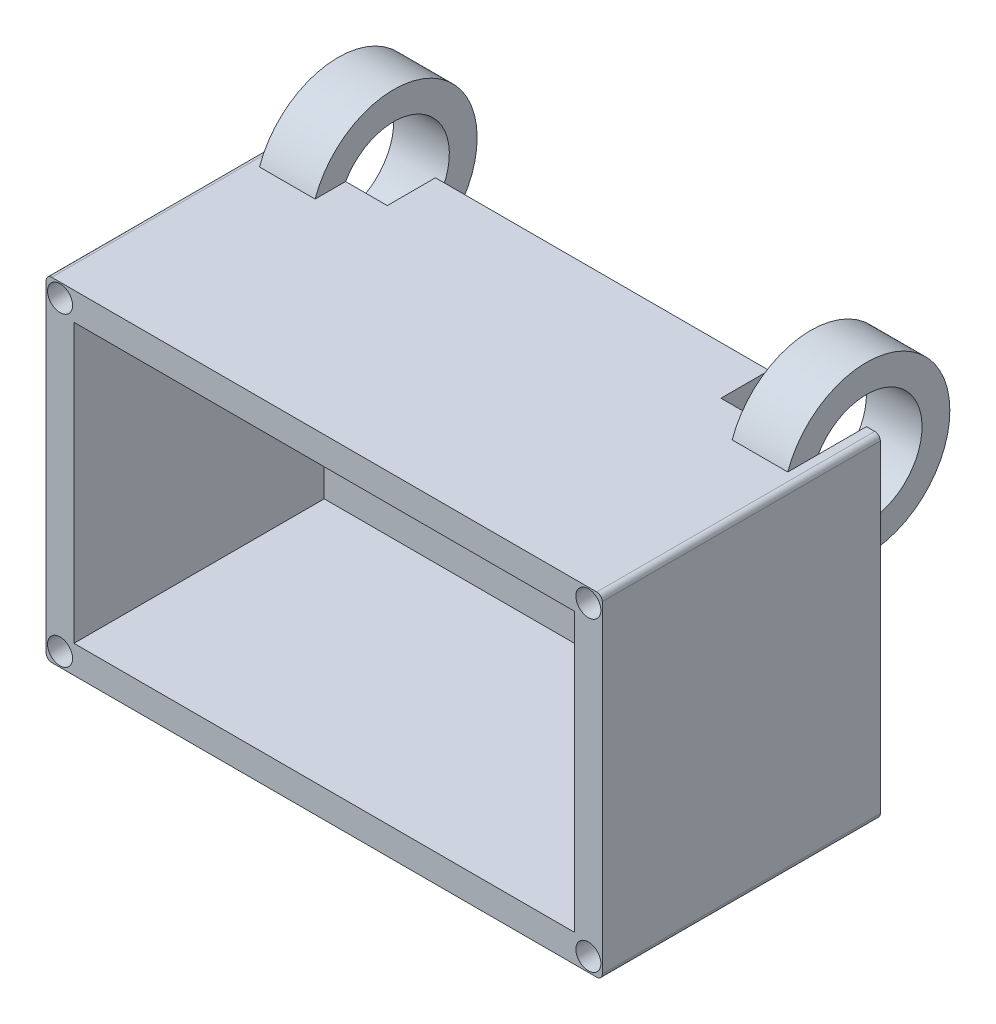
from build123d import *

# Parameters (mm, degrees)
SKETCH1_W           = 200
SKETCH1_H           = 120
BOSS_EXTRUDE1_DEPTH = 100
SHELL1_T            = -10
SKETCH2_R           = 30
BOSS_EXTRUDE2_DEPTH = 20
BOSS_EXTRUDE3_START = 20
SKETCH3_R           = 30
BOSS_EXTRUDE3_DEPTH = 20
SKETCH4_R           = 20
CUT_EXTRUDE1_DEPTH  = 35
CUT_EXTRUDE2_START  = -35
SKETCH5_R           = 20
CUT_EXTRUDE2_DEPTH  = 35
SKETCH7_R           = 4.5
CUT_EXTRUDE3_DEPTH  = 10
CUT_EXTRUDE4_START  = 10
SKETCH8_R           = 4.5
CUT_EXTRUDE4_DEPTH  = 10
FILLET1_R           = 2


with BuildPart() as part:
    # Sketch1 → Boss-Extrude1 (new body)
    with BuildSketch(Plane.XY):
        Rectangle(SKETCH1_W, SKETCH1_H)
    extrude(amount=BOSS_EXTRUDE1_DEPTH)

    # Shell1
    shell1_openings = [part.faces().sort_by_distance(p)[0] for p in [
        (0, 0, 100),
    ]]
    offset(amount=SHELL1_T, openings=shell1_openings, kind=Kind.INTERSECTION)

    # Sketch2 → Boss-Extrude2 (add)
    with BuildSketch(Plane(origin=(-75, 0, 0), x_dir=(0, 0, -1), z_dir=(1, 0, 0))):
        with Locations((0, 50)):
            Circle(SKETCH2_R)
    extrude(amount=-BOSS_EXTRUDE2_DEPTH)

    # Sketch3 → Boss-Extrude3 (add)
    with BuildSketch(Plane(origin=(75, 0, 0), x_dir=(0, 0, -1), z_dir=(1, 0, 0)).offset(BOSS_EXTRUDE3_START)):
        with Locations((0, 50)):
            Circle(SKETCH3_R)
    extrude(amount=-BOSS_EXTRUDE3_DEPTH)

    # Sketch4 → Cut-Extrude1 (cut)
    with BuildSketch(Plane(origin=(-95, 0, 0), x_dir=(0, 0, -1), z_dir=(1, 0, 0))):
        with Locations((0, 50)):
            Circle(SKETCH4_R)
    extrude(amount=CUT_EXTRUDE1_DEPTH, mode=Mode.SUBTRACT)

    # Sketch5 → Cut-Extrude2 (cut)
    with BuildSketch(Plane(origin=(95, 0, 0), x_dir=(0, 0, -1), z_dir=(1, 0, 0)).offset(CUT_EXTRUDE2_START)):
        with Locations((0, 50)):
            Circle(SKETCH5_R)
    extrude(amount=CUT_EXTRUDE2_DEPTH, mode=Mode.SUBTRACT)

    # Sketch7 → Cut-Extrude3 (cut)
    with BuildSketch(Plane.XY.offset(100)):
        with Locations((95, 55)):
            Circle(SKETCH7_R)
        with Locations((95, -55)):
            Circle(SKETCH7_R)
        with Locations((-95, 55)):
            Circle(SKETCH7_R)
        with Locations((-95, -55)):
            Circle(SKETCH7_R)
    extrude(amount=-CUT_EXTRUDE3_DEPTH, mode=Mode.SUBTRACT)

    # Sketch8 → Cut-Extrude4 (cut)
    with BuildSketch(Plane.XY.offset(CUT_EXTRUDE4_START)):
        with Locations((95, 55)):
            Circle(SKETCH8_R)
        with Locations((95, -55)):
            Circle(SKETCH8_R)
        with Locations((-95, 55)):
            Circle(SKETCH8_R)
        with Locations((-95, -55)):
            Circle(SKETCH8_R)
    extrude(amount=-CUT_EXTRUDE4_DEPTH, mode=Mode.SUBTRACT)

    # Fillet1
    fillet1_edges = [part.edges().sort_by_distance(p)[0] for p in [
        (-100, -60, 50),
        (-100, 60, 50),
        (100, -60, 50),
        (100, 60, 50),
    ]]
    fillet(fillet1_edges, radius=FILLET1_R)


solid = part.part
